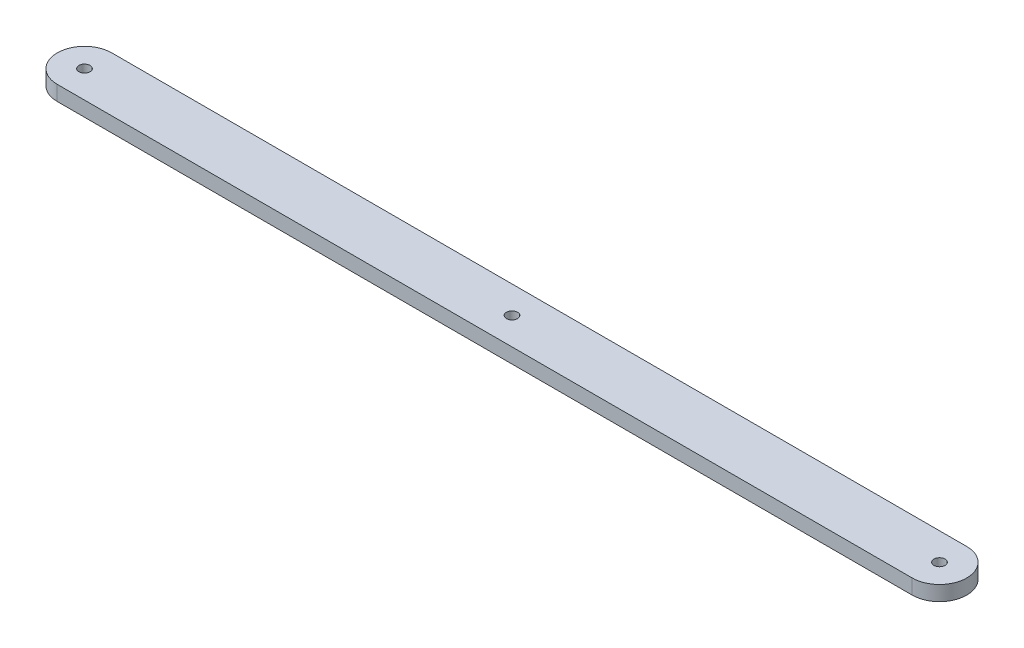
from build123d import *

# Parameters (mm, degrees)
SKETCH1_R           = 1.625
BOSS_EXTRUDE1_DEPTH = 4.35


with BuildPart() as part:
    # Sketch1 → Boss-Extrude1 (new body)
    with BuildSketch(Plane(origin=(0, 0, 0), x_dir=(1, 0, 0), z_dir=(0, 1, 0))):
        with BuildLine():
            Line((0, 7.973476097), (250, 7.973476097))
            ThreePointArc((250, 7.973476097), (257.973476097, 0), (250, -7.973476097))
            Line((250, -7.973476097), (0, -7.973476097))
            ThreePointArc((0, -7.973476097), (-7.973476097, 0), (0, 7.973476097))
        make_face()
        with Locations(Location((250, 0, 0), (0, 0, 270))):
            Circle(SKETCH1_R, mode=Mode.SUBTRACT)
        with Locations(Location((125, 0, 0), (0, 0, 270))):
            Circle(SKETCH1_R, mode=Mode.SUBTRACT)
        with Locations(Location((0, 0, 0), (0, 0, 270))):
            Circle(SKETCH1_R, mode=Mode.SUBTRACT)
    extrude(amount=BOSS_EXTRUDE1_DEPTH)


solid = part.part
